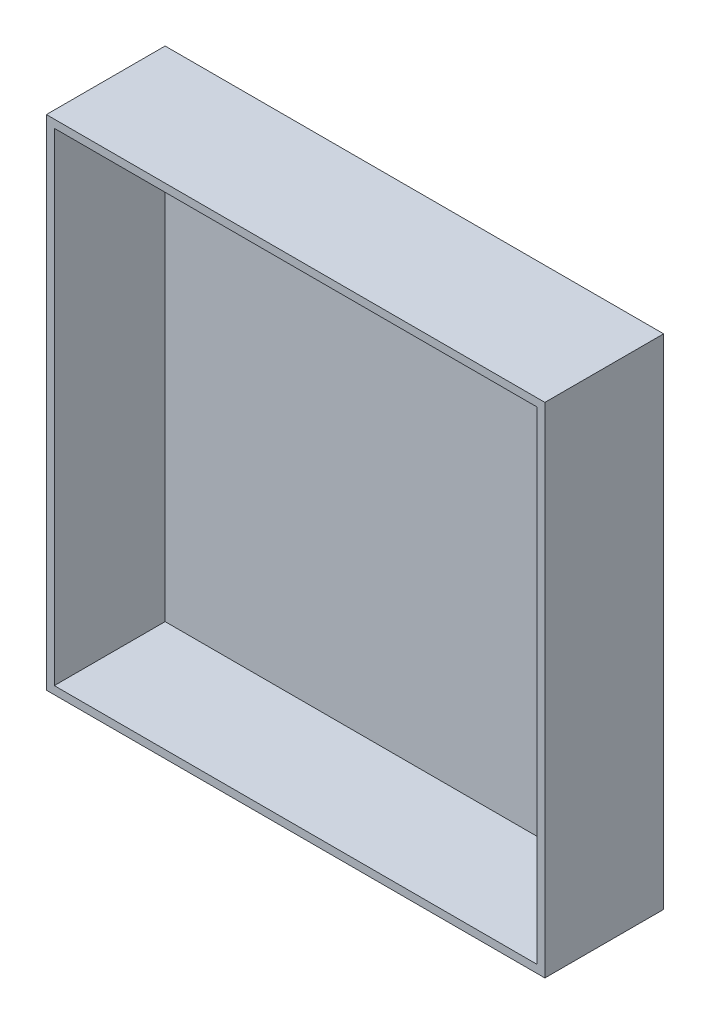
from build123d import *

# Parameters (mm, degrees)
EXTRUDE_START     = -5
SKETCH_1_W        = 62.97
SKETCH_1_H        = 62.97
SKETCH_1_W_2      = 60.97
SKETCH_1_H_2      = 60.97
EXTRUDE_1_DEPTH   = 14
SKETCH_3_W        = 62.97
SKETCH_3_H        = 62.97
EXTRUDE_1_2_DEPTH = 1


with BuildPart() as part:
    # 草图1 → Extrude 1 (new body)
    with BuildSketch(Plane.XY.offset(EXTRUDE_START)):
        with Locations((29.873059436, -30.254060198)):
            Rectangle(SKETCH_1_W, SKETCH_1_H)
        with Locations((29.873059436, -30.254060198)):
            Rectangle(SKETCH_1_W_2, SKETCH_1_H_2, mode=Mode.SUBTRACT)
    extrude(amount=EXTRUDE_1_DEPTH)

    # 草图3 → Extrude 1 2 (add)
    with BuildSketch(Plane(origin=(0, 0, -5), x_dir=(-1, 0, 0), z_dir=(0, 0, -1))):
        with Locations((-29.873059436, -30.254060198)):
            Rectangle(SKETCH_3_W, SKETCH_3_H)
    extrude(amount=EXTRUDE_1_2_DEPTH)


solid = part.part
